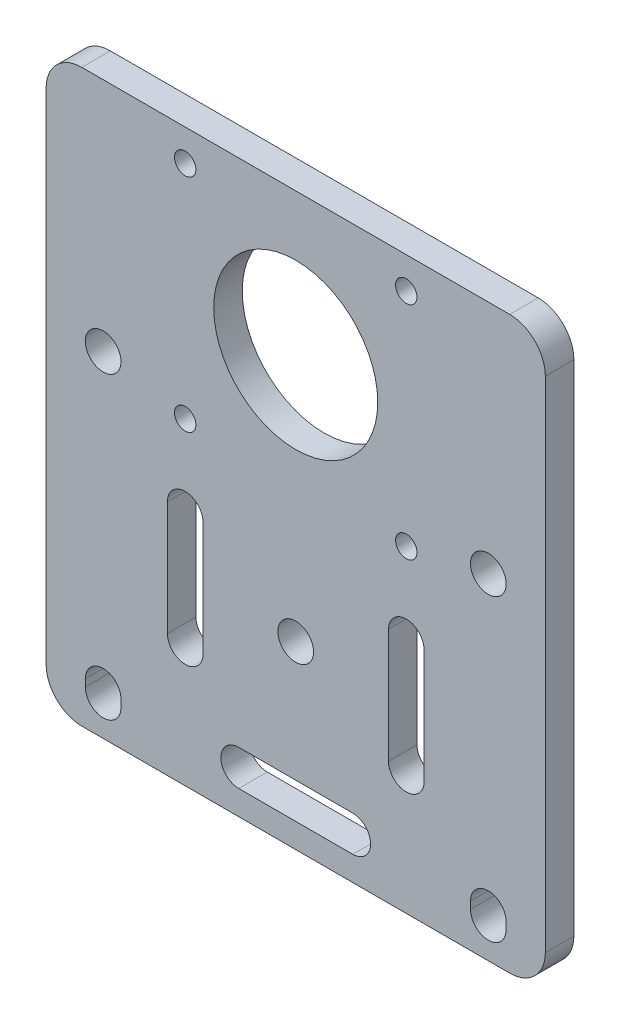
from build123d import *

# Parameters (mm, degrees)
SKETCH4_W           = 70
SKETCH4_H           = 80
SKETCH4_R           = 2.5
BOSS_EXTRUDE2_DEPTH = 4
SKETCH5_R           = 11.5
SKETCH5_R_2         = 1.5
SKETCH5_R_3         = 2.5
CUT_EXTRUDE2_DEPTH  = 54.301031885
FILLET1_R           = 5


with BuildPart() as part:
    # Sketch4 → Boss-Extrude2 (new body)
    with BuildSketch(Plane.XY):
        Rectangle(SKETCH4_W, SKETCH4_H)
        with Locations((-27, 7)):
            Circle(SKETCH4_R, mode=Mode.SUBTRACT)
        with Locations(Location((27, 7, 0), (0, 0, 180))):
            Circle(SKETCH4_R, mode=Mode.SUBTRACT)
        with BuildLine():
            Line((-24.5, -34), (-24.5, -35))
            ThreePointArc((-24.5, -35), (-27, -37.5), (-29.5, -35))
            Line((-29.5, -35), (-29.5, -34))
            ThreePointArc((-29.5, -34), (-27, -31.5), (-24.5, -34))
        make_face(mode=Mode.SUBTRACT)
        with BuildLine():
            Line((24.5, -34), (24.5, -35))
            ThreePointArc((24.5, -35), (27, -37.5), (29.5, -35))
            Line((29.5, -35), (29.5, -34))
            ThreePointArc((29.5, -34), (27, -31.5), (24.5, -34))
        make_face(mode=Mode.SUBTRACT)
    extrude(amount=BOSS_EXTRUDE2_DEPTH)

    # Sketch5 → Cut-Extrude2 (cut, through all)
    with BuildSketch(Plane.XY.offset(4)):
        with Locations((0, 20.076696831)):
            Circle(SKETCH5_R)
        with Locations((-15.5, 35.576696831)):
            Circle(SKETCH5_R_2)
        with Locations(Location((15.5, 35.576696831, 0), (0, 0, 180))):
            Circle(SKETCH5_R_2)
        with Locations((15.5, 4.576696831)):
            Circle(SKETCH5_R_2)
        with Locations(Location((-15.5, 4.576696831, 0), (0, 0, 180))):
            Circle(SKETCH5_R_2)
        with Locations((0, -14.75)):
            Circle(SKETCH5_R_3)
        with BuildLine():
            Line((-8, -31.570071963), (8, -31.570071963))
            ThreePointArc((8, -31.570071963), (10.5, -34.070071963), (8, -36.570071963))
            Line((8, -36.570071963), (-8, -36.570071963))
            ThreePointArc((-8, -36.570071963), (-10.5, -34.070071963), (-8, -31.570071963))
        make_face()
        with BuildLine():
            Line((-13, -6.75), (-13, -22.75))
            ThreePointArc((-13, -22.75), (-15.5, -25.25), (-18, -22.75))
            Line((-18, -22.75), (-18, -6.75))
            ThreePointArc((-18, -6.75), (-15.5, -4.25), (-13, -6.75))
        make_face()
        with BuildLine():
            Line((13, -6.75), (13, -22.75))
            ThreePointArc((13, -22.75), (15.5, -25.25), (18, -22.75))
            Line((18, -22.75), (18, -6.75))
            ThreePointArc((18, -6.75), (15.5, -4.25), (13, -6.75))
        make_face()
    extrude(amount=-CUT_EXTRUDE2_DEPTH, mode=Mode.SUBTRACT)

    # Fillet1
    fillet1_edges = [part.edges().sort_by_distance(p)[0] for p in [
        (35, -40, 2),
        (-35, -40, 2),
        (-35, 40, 2),
        (35, 40, 2),
    ]]
    fillet(fillet1_edges, radius=FILLET1_R)


solid = part.part
